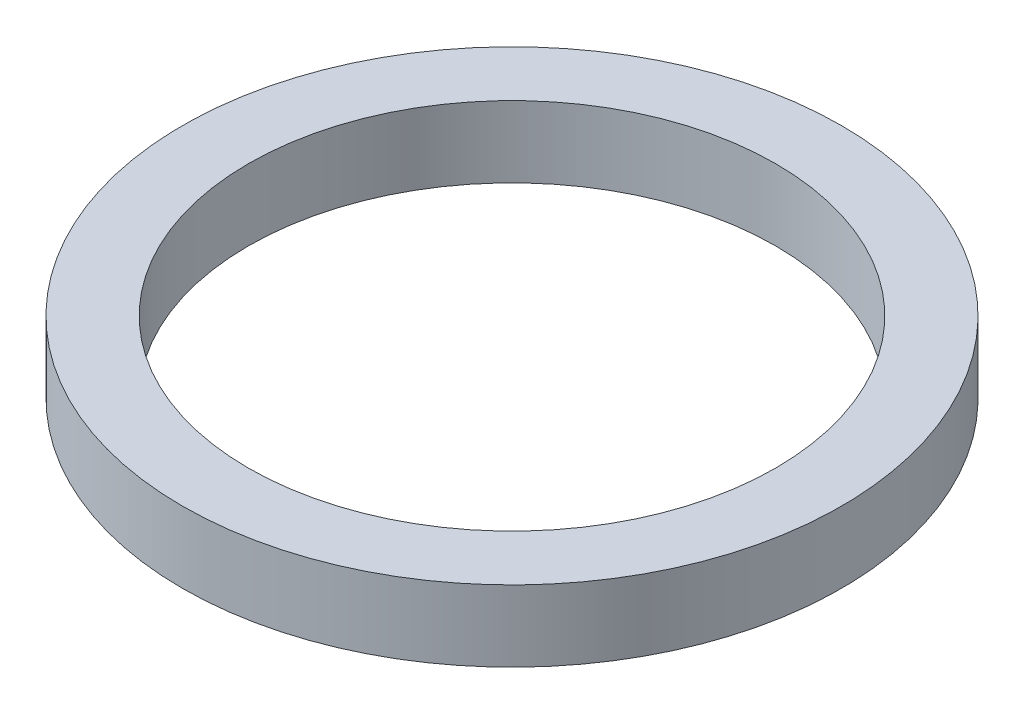
from build123d import *

# Parameters (mm, degrees)
SKIZZE1_R                       = 9.25
SKIZZE1_R_2                     = 7.4
AUFSATZ_LINEAR_AUSTRAGEN1_DEPTH = 2


with BuildPart() as part:
    # Skizze1 → Aufsatz-Linear austragen1 (new body)
    with BuildSketch(Plane(origin=(0, 0, 0), x_dir=(1, 0, 0), z_dir=(0, 1, 0))):
        with Locations(Location((0, 0, 0), (0, 0, 270))):
            Circle(SKIZZE1_R)
        with Locations(Location((0, 0, 0), (0, 0, 270))):
            Circle(SKIZZE1_R_2, mode=Mode.SUBTRACT)
    extrude(amount=AUFSATZ_LINEAR_AUSTRAGEN1_DEPTH)


solid = part.part
